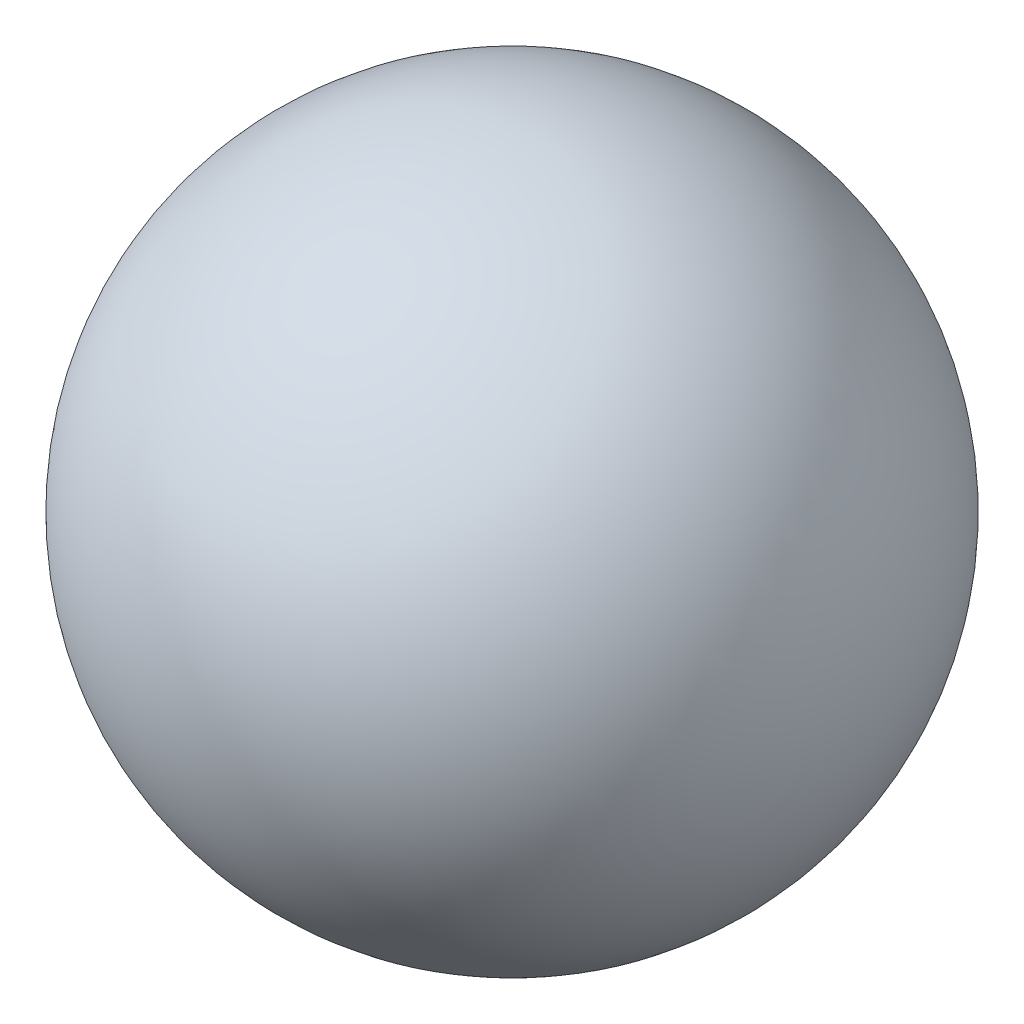
from build123d import *


with BuildPart() as part:
    # Sketch2 → Revolve1 (revolve)
    with BuildSketch(Plane.XY):
        with BuildLine():
            Line((0, 0.3302), (0, -0.3302))
            ThreePointArc((0, -0.3302), (0.3302, 0), (0, 0.3302))
        make_face()
    revolve(axis=Axis((0, 0.3302, 0), (0, -1, 0)))


solid = part.part
